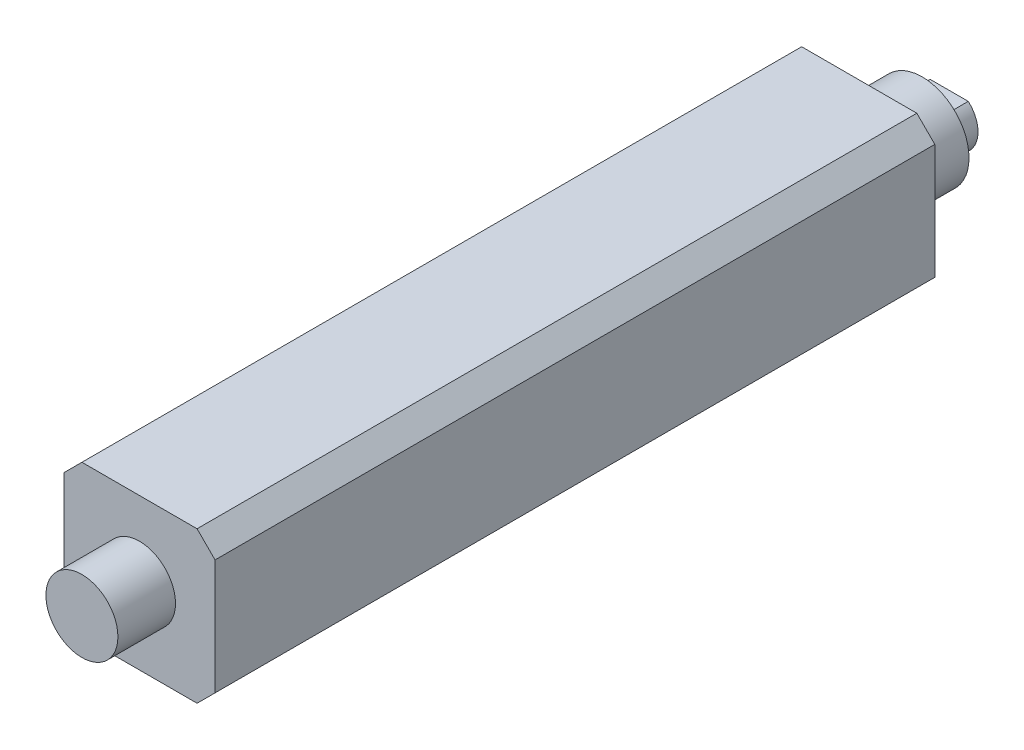
from build123d import *

# Parameters (mm, degrees)
EXTRUDE_1_DEPTH     = 200
SKETCH_2_R          = 15
EXTRUDE_2_DEPTH     = 3
SKETCH_3_R          = 13
EXTRUDE_3_DEPTH     = 14.5
SKETCH_4_R          = 8
EXTRUDE_4_DEPTH     = 7.5
SKETCH_5_R          = 10
EXTRUDE_5_DEPTH     = 16
CUT_EXTRUDE_START   = -5
CUT_EXTRUDE_1_DEPTH = 5
M10X1_25_1_D        = 8.8
M10X1_25_1_DEPTH    = 15
M10X1_25_1_TIP      = 2.643786724


with BuildPart() as part:
    # 스케치1 → 보스-돌출1 (new body)
    with BuildSketch(Plane.XY):
        Polygon((-21, 16), (-16, 21), (16, 21), (21, 16), (21, -16), (16, -21), (-16, -21), (-21, -16), align=None)
    extrude(amount=EXTRUDE_1_DEPTH)

    # 스케치2 → 보스-돌출2 (add)
    with BuildSketch(Plane.XY):
        Circle(SKETCH_2_R)
    extrude(amount=-EXTRUDE_2_DEPTH)

    # 스케치3 → 보스-돌출3 (add)
    with BuildSketch(Plane(origin=(0, 0, -3), x_dir=(-1, 0, 0), z_dir=(0, 0, -1))):
        with Locations(Location((0, 0, 0), (0, 0, 180))):
            Circle(SKETCH_3_R)
    extrude(amount=EXTRUDE_3_DEPTH)

    # 스케치4 → 보스-돌출4 (add)
    with BuildSketch(Plane(origin=(0, 0, -17.5), x_dir=(-1, 0, 0), z_dir=(0, 0, -1))):
        Circle(SKETCH_4_R)
    extrude(amount=EXTRUDE_4_DEPTH)

    # 스케치5 → 보스-돌출5 (add)
    with BuildSketch(Plane.XY.offset(200)):
        Circle(SKETCH_5_R)
    extrude(amount=EXTRUDE_5_DEPTH)

    # 스케치6 → 컷-돌출1 (cut)
    with BuildSketch(Plane(origin=(0, 0, -25), x_dir=(-1, 0, 0), z_dir=(0, 0, -1)).offset(CUT_EXTRUDE_START)):
        with BuildLine():
            Line((-5.291502622, 6), (5.291502622, 6))
            ThreePointArc((5.291502622, 6), (0, 8), (-5.291502622, 6))
        make_face()
        with BuildLine():
            Line((-5.291502622, -6), (5.291502622, -6))
            ThreePointArc((5.291502622, -6), (0, -8), (-5.291502622, -6))
        make_face()
    extrude(amount=CUT_EXTRUDE_1_DEPTH, mode=Mode.SUBTRACT)

    # M10x1.25 탭을 위한 탭 드릴1
    with Locations(Plane(origin=(0, 0, -25), x_dir=(-1, 0, 0), z_dir=(0, 0, -1))):
        with Locations((0, 0)):
            Hole(M10X1_25_1_D / 2, depth=M10X1_25_1_DEPTH)
            with Locations((0, 0, -(M10X1_25_1_DEPTH + M10X1_25_1_TIP / 2))):  # 118° drill point
                Cone(0, M10X1_25_1_D / 2, M10X1_25_1_TIP, mode=Mode.SUBTRACT)


solid = part.part
